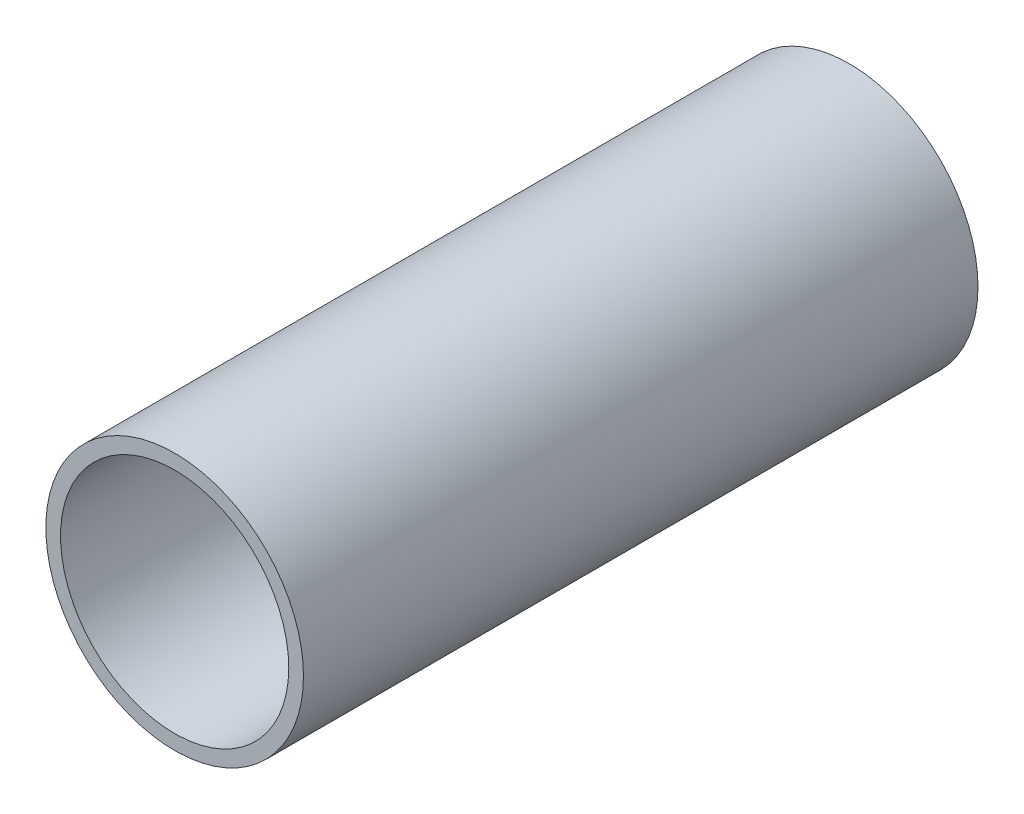
from build123d import *

# Parameters (mm, degrees)
ESQUISSE1_R        = 57
ESQUISSE1_R_2      = 50.5
BOSS_EXTRU_1_DEPTH = 298.5


with BuildPart() as part:
    # Esquisse1 → Boss.-Extru.1 (new body)
    with BuildSketch(Plane.XY):
        Circle(ESQUISSE1_R)
        Circle(ESQUISSE1_R_2, mode=Mode.SUBTRACT)
    extrude(amount=BOSS_EXTRU_1_DEPTH)


solid = part.part
